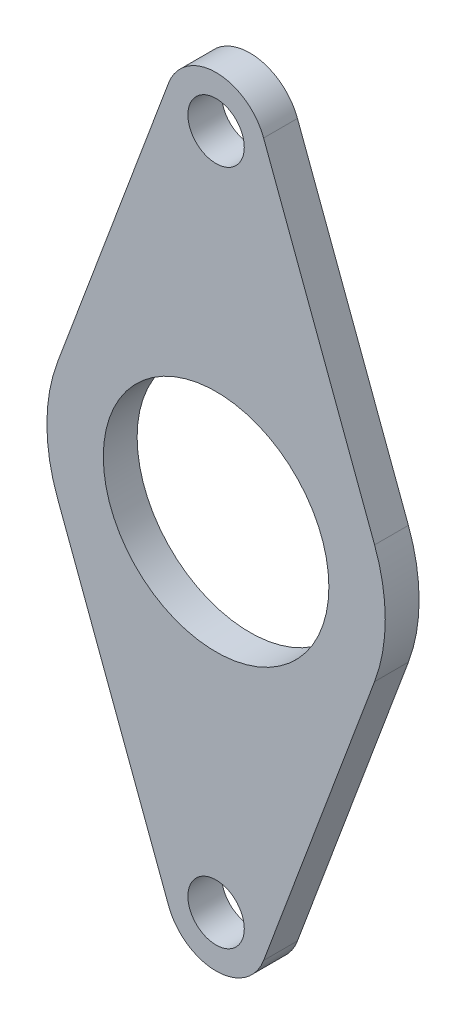
from build123d import *

# Parameters (mm, degrees)
SKETCH_1_R      = 2.5
SKETCH_1_R_2    = 10
EXTRUDE_1_DEPTH = 3


with BuildPart() as part:
    # 草图1 → 凸台-拉伸1 (new body)
    with BuildSketch(Plane.XY):
        with BuildLine():
            Line((-4.215373649, 31.575), (-14.051245496, 5.25))
            ThreePointArc((-14.051245496, 5.25), (-15, 0), (-14.051245496, -5.25))
            Line((-14.051245496, -5.25), (-4.215373649, -31.575))
            ThreePointArc((-4.215373649, -31.575), (0, -34.5), (4.215373649, -31.575))
            Line((4.215373649, -31.575), (14.051245496, -5.25))
            ThreePointArc((14.051245496, -5.25), (15, 0), (14.051245496, 5.25))
            Line((14.051245496, 5.25), (4.215373649, 31.575))
            ThreePointArc((4.215373649, 31.575), (0, 34.5), (-4.215373649, 31.575))
        make_face()
        with Locations((0, 30)):
            Circle(SKETCH_1_R, mode=Mode.SUBTRACT)
        with Locations((0, -30)):
            Circle(SKETCH_1_R, mode=Mode.SUBTRACT)
        Circle(SKETCH_1_R_2, mode=Mode.SUBTRACT)
    extrude(amount=EXTRUDE_1_DEPTH)


solid = part.part
